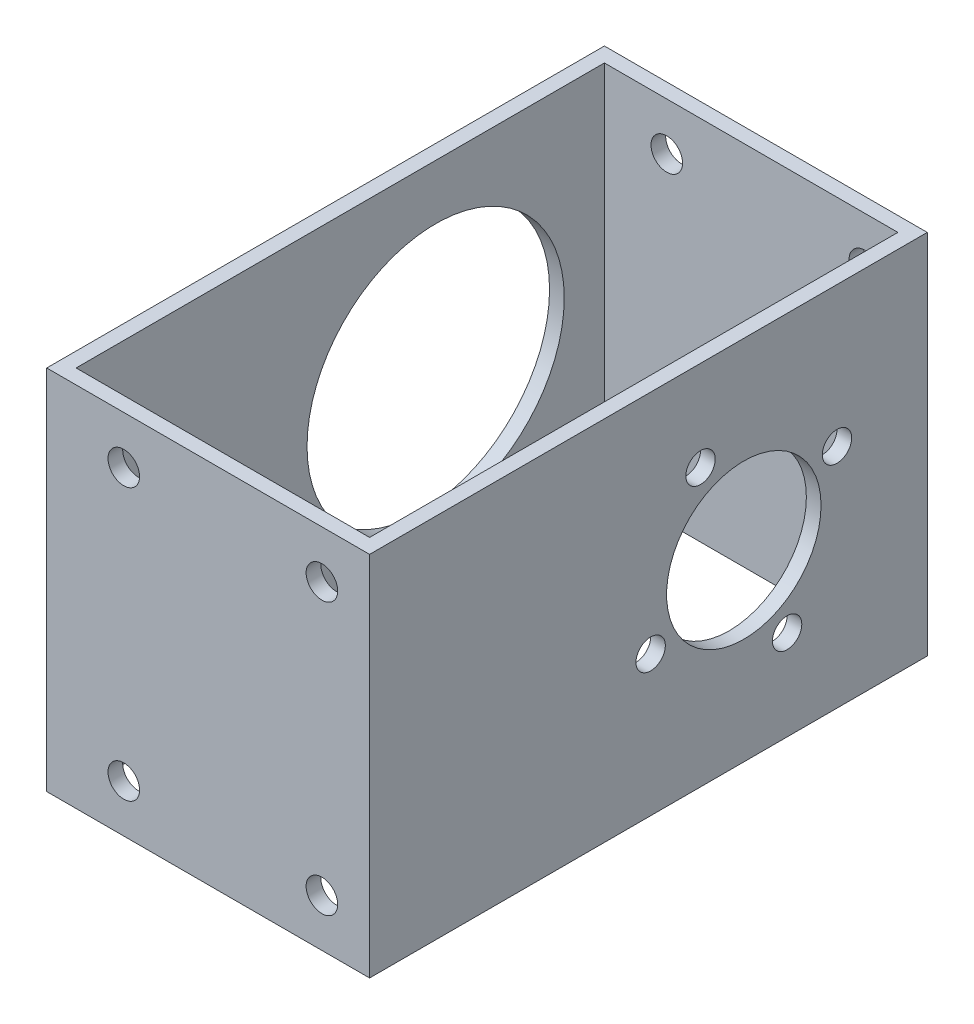
from build123d import *

# Parameters (mm, degrees)
SKETCH_1_W          = 44
SKETCH_1_H          = 76
SKETCH_1_W_2        = 40
SKETCH_1_H_2        = 72
EXTRUDE_1_DEPTH     = 50
SKETCH_2_R          = 2.15
CUT_EXTRUDE_1_DEPTH = 102.054440773
CUT_EXTRUDE_2_REACH = 103.054
SKETCH_3_R          = 17.525
CUT_EXTRUDE_3_REACH = 103.054
SKETCH_4_R          = 10.525
SKETCH_12_R         = 2
CUT_EXTRUDE_7_DEPTH = 10


with BuildPart() as part:
    # 草图1 → 凸台-拉伸1 (new body)
    with BuildSketch(Plane(origin=(0, 0, 0), x_dir=(1, 0, 0), z_dir=(0, 1, 0))):
        with Locations((22, -38)):
            Rectangle(SKETCH_1_W, SKETCH_1_H)
        with Locations((22, -38)):
            Rectangle(SKETCH_1_W_2, SKETCH_1_H_2, mode=Mode.SUBTRACT)
    extrude(amount=EXTRUDE_1_DEPTH)

    # 草图2 → 切除-拉伸1 (cut, through all)
    with BuildSketch(Plane(origin=(0, 0, 0), x_dir=(-1, 0, 0), z_dir=(0, 0, -1))):
        with Locations((-10.5, 6.5)):
            Circle(SKETCH_2_R)
        with Locations((-37.5, 6.5)):
            Circle(SKETCH_2_R)
        with Locations((-37.5, 43.5)):
            Circle(SKETCH_2_R)
        with Locations((-10.5, 43.5)):
            Circle(SKETCH_2_R)
    extrude(amount=-CUT_EXTRUDE_1_DEPTH, mode=Mode.SUBTRACT)

    # 草图3 → Cut-Extrude 2 (cut, up to next)
    with BuildSketch(Plane.ZY, mode=Mode.PRIVATE) as cut_extrude_2_sk1:
        with Locations((25, 25)):
            Circle(SKETCH_3_R)
    cut_extrude_2_tool1 = extrude(cut_extrude_2_sk1.sketch, amount=-CUT_EXTRUDE_2_REACH, mode=Mode.PRIVATE) & part.part
    add(cut_extrude_2_tool1.solids().sort_by_distance((0, 25, 25))[0], mode=Mode.SUBTRACT)

    # 草图4 → Cut-Extrude 3 (cut, up to next)
    with BuildSketch(Plane(origin=(44, 0, 0), x_dir=(0, 0, -1), z_dir=(1, 0, 0)), mode=Mode.PRIVATE) as cut_extrude_3_sk1:
        with Locations((-25, 25)):
            Circle(SKETCH_4_R)
    cut_extrude_3_tool1 = extrude(cut_extrude_3_sk1.sketch, amount=-CUT_EXTRUDE_3_REACH, mode=Mode.PRIVATE) & part.part
    add(cut_extrude_3_tool1.solids().sort_by_distance((44, 25, 25))[0], mode=Mode.SUBTRACT)

    # 草图12 → 电机7号 (cut)
    with BuildSketch(Plane(origin=(44, 0, 0), x_dir=(0, 0, -1), z_dir=(1, 0, 0))):
        with Locations((-12.303937618, 30.9)):
            Circle(SKETCH_12_R)
        with Locations((-19.1, 12.303937618)):
            Circle(SKETCH_12_R)
        with Locations((-37.696062382, 19.1)):
            Circle(SKETCH_12_R)
        with Locations((-30.9, 37.696062382)):
            Circle(SKETCH_12_R)
    extrude(amount=-CUT_EXTRUDE_7_DEPTH, mode=Mode.SUBTRACT)


solid = part.part
